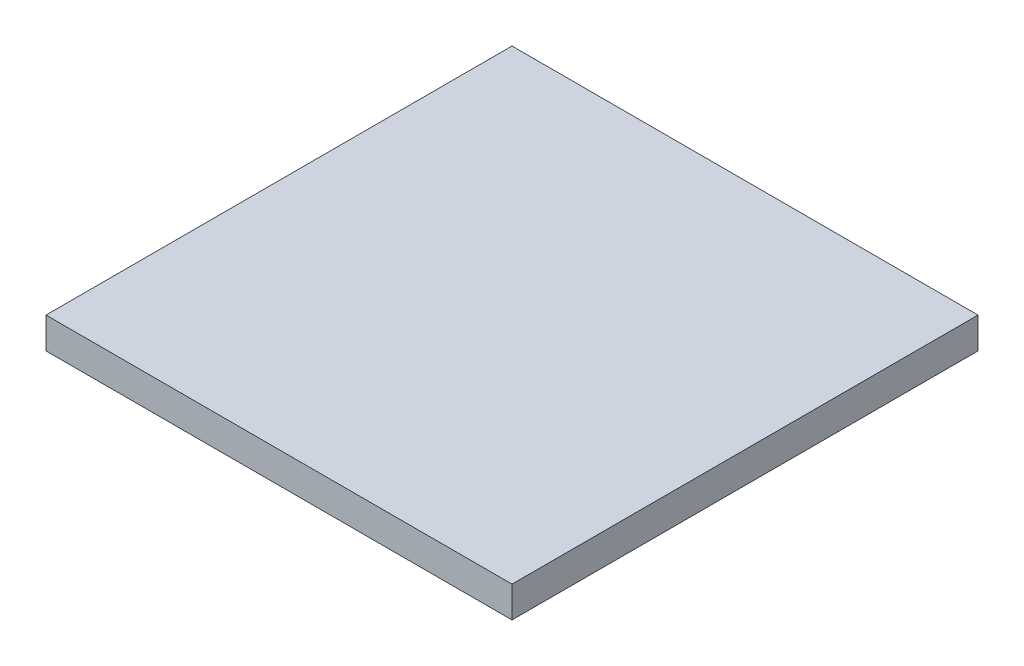
from build123d import *

# Parameters (mm, degrees)
SKETCH1_W           = 300
SKETCH1_H           = 300
BOSS_EXTRUDE1_DEPTH = 20


with BuildPart() as part:
    # Sketch1 → Boss-Extrude1 (new body)
    with BuildSketch(Plane(origin=(0, 0, 0), x_dir=(1, 0, 0), z_dir=(0, 1, 0))):
        Rectangle(SKETCH1_W, SKETCH1_H)
    extrude(amount=BOSS_EXTRUDE1_DEPTH)


solid = part.part
